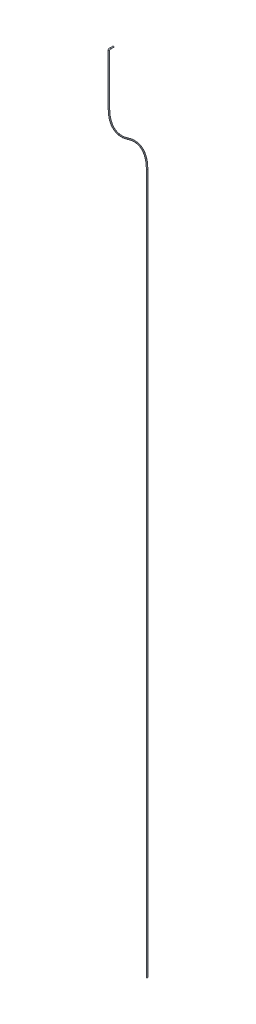
from build123d import *

# Parameters (mm, degrees)
NATIVE_HOLLOW_UTILITY_SWEEP_PROFILE_R = 0.18


with BuildPart() as part:
    # Native hollow utility sweep: sweep along a path in Illustrative smooth utility route
    with BuildLine(Plane(origin=(0, 0, 0), x_dir=(0, 0, -1), z_dir=(1, 0, 0))) as native_hollow_utility_sweep_path:
        Line((-15.85, 0), (-17.05, 0))
        ThreePointArc((-17.05, 0), (-17.262132034, -0.087867966), (-17.35, -0.3))
        Line((-17.35, -0.3), (-17.35, -17.32))
        ThreePointArc((-17.35, -17.32), (-15.642666611, -24.12589129), (-10.925, -29.32))
        ThreePointArc((-10.925, -29.32), (-6.207333389, -34.51410871), (-4.5, -41.32))
        Line((-4.5, -41.32), (-4.5, -277.32))
    # Native hollow utility sweep profile (on start of the path) → Native hollow utility sweep (sweep)
    with BuildSketch(Plane.XY.offset(15.85)):
        Circle(NATIVE_HOLLOW_UTILITY_SWEEP_PROFILE_R)
    sweep(path=native_hollow_utility_sweep_path.line)


solid = part.part
